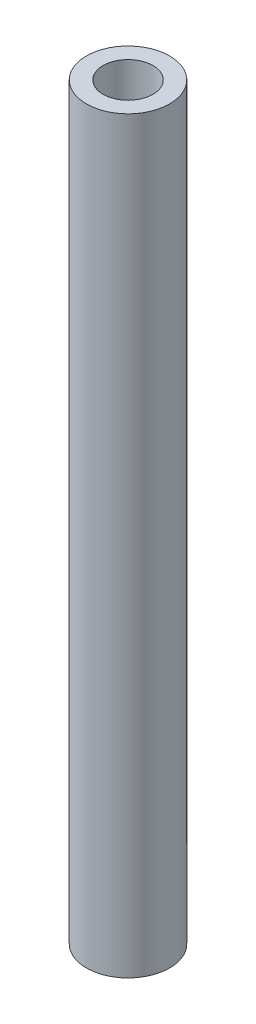
from build123d import *

# Parameters (mm, degrees)
SKETCH_1_R      = 2.5
SKETCH_1_R_2    = 1.5
EXTRUDE_1_DEPTH = 45


with BuildPart() as part:
    # 草图1 → 凸台-拉伸1 (new body)
    with BuildSketch(Plane(origin=(0, 0, 0), x_dir=(1, 0, 0), z_dir=(0, 1, 0))):
        with Locations(Location((0, 0, 0), (0, 0, 90))):
            Circle(SKETCH_1_R)
        with Locations(Location((0, 0, 0), (0, 0, 90))):
            Circle(SKETCH_1_R_2, mode=Mode.SUBTRACT)
    extrude(amount=EXTRUDE_1_DEPTH)


solid = part.part
